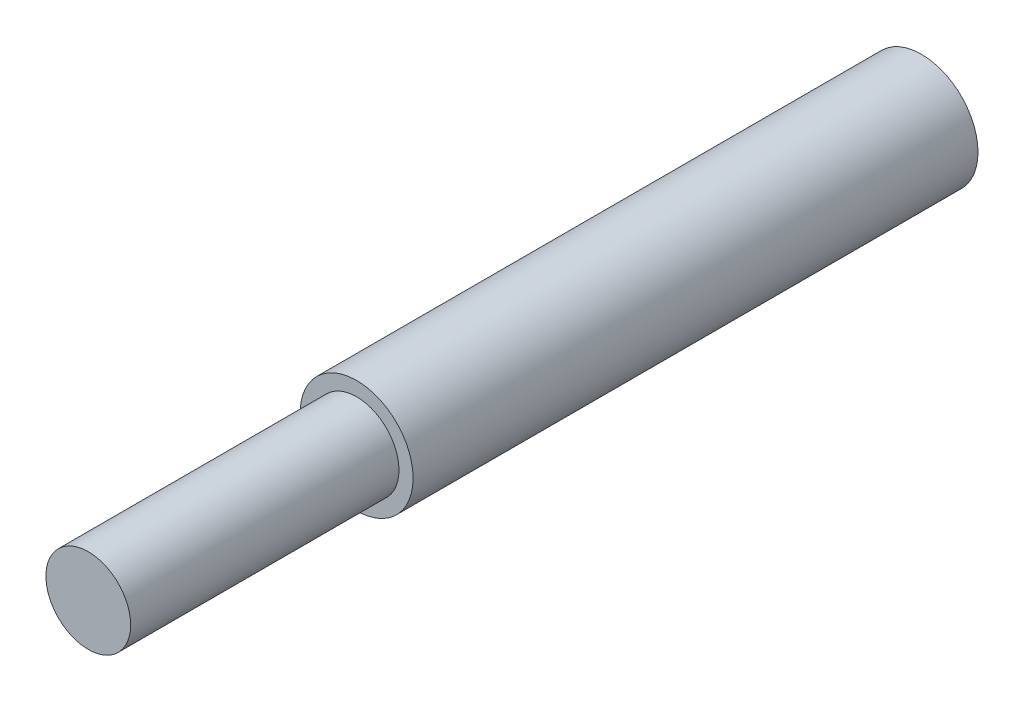
from build123d import *

# Parameters (mm, degrees)
S01_GROUND_8_MM_SLIDING_SURFACE_R       = 4
F_01_GROUND_8_MM_SLIDING_SURFACE_DEPTH  = 40
F_02_START                              = 40
S02_M6_RETAINING_THREAD_ENVELOPE_R      = 3
F_02_M6_RETAINING_THREAD_ENVELOPE_DEPTH = 19


with BuildPart() as part:
    # S01 - Ground 8 mm sliding surface → 01 - Ground 8 mm sliding surface (new body)
    with BuildSketch(Plane.XY):
        Circle(S01_GROUND_8_MM_SLIDING_SURFACE_R)
    extrude(amount=F_01_GROUND_8_MM_SLIDING_SURFACE_DEPTH)

    # S02 - M6 retaining thread envelope → 02 - M6 retaining thread envelope (add)
    with BuildSketch(Plane.XY.offset(F_02_START)):
        Circle(S02_M6_RETAINING_THREAD_ENVELOPE_R)
    extrude(amount=F_02_M6_RETAINING_THREAD_ENVELOPE_DEPTH)


solid = part.part
